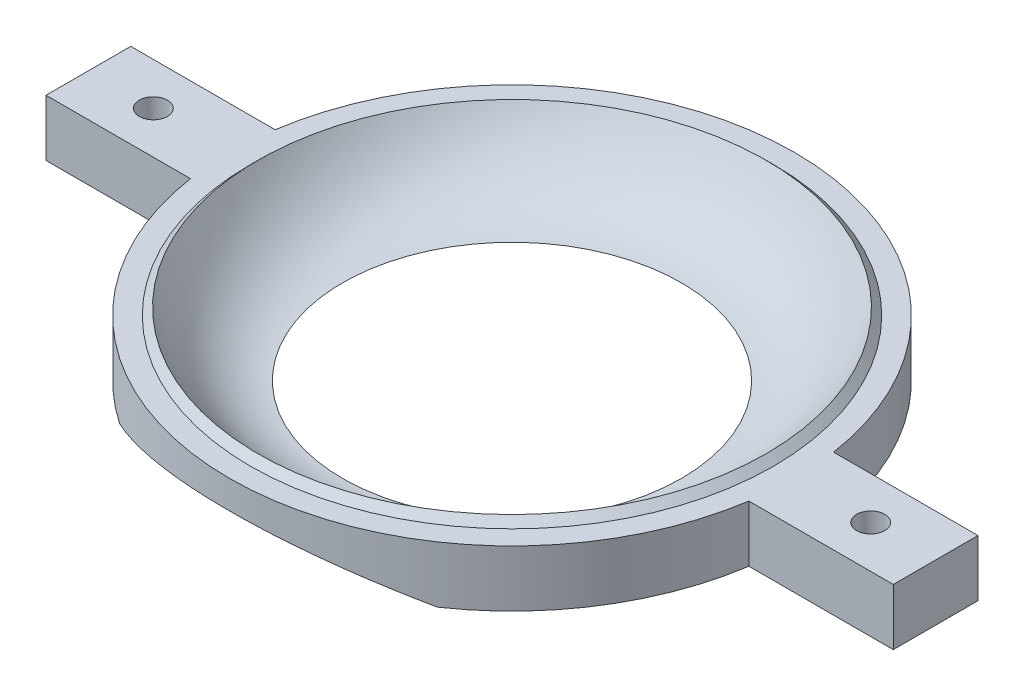
from build123d import *

# Parameters (mm, degrees)
SKETCH1_R           = 0.5
BOSS_EXTRUDE1_DEPTH = 1
CUT_EXTRUDE1_START  = -15
CUT_EXTRUDE1_DEPTH  = 30


with BuildPart() as part:
    # Sketch1 → Boss-Extrude1 (new, symmetric)
    # profile 1 of 14: a face of its own
    with BuildSketch(Plane(origin=(0, 0, 0), x_dir=(1, 0, 0), z_dir=(0, 1, 0))):
        with BuildLine():
            Line((-15, -1.5), (-9.886859967, -1.5))
            ThreePointArc((-9.886859967, -1.5), (-10, 0), (-9.886859967, 1.5))
            Line((-9.886859967, 1.5), (-15, 1.5))
            Line((-15, 1.5), (-15, -1.5))
        make_face()
        with Locations(Location((-12.7, 0, 0), (0, 0, 270))):
            Circle(SKETCH1_R, mode=Mode.SUBTRACT)
    # profile 2 of 14: a face of its own
    with BuildSketch(Plane(origin=(0, 0, 0), x_dir=(1, 0, 0), z_dir=(0, 1, 0))):
        with BuildLine():
            ThreePointArc((-9.886859967, 1.5), (-10, 0), (-9.886859967, -1.5))
            Line((-9.886859967, -1.5), (-8.874119675, -1.5))
            ThreePointArc((-8.874119675, -1.5), (-9, 0), (-8.874119675, 1.5))
            Line((-8.874119675, 1.5), (-9.886859967, 1.5))
        make_face()
    # profile 3 of 14: a face of its own
    with BuildSketch(Plane(origin=(0, 0, 0), x_dir=(1, 0, 0), z_dir=(0, 1, 0))):
        with BuildLine():
            Line((8.874119675, -1.5), (9.886859967, -1.5))
            ThreePointArc((9.886859967, -1.5), (9.971674876, -0.752130419), (10, 0))
            ThreePointArc((10, 0), (9.971674876, 0.752130419), (9.886859967, 1.5))
            Line((9.886859967, 1.5), (8.874119675, 1.5))
            ThreePointArc((8.874119675, 1.5), (8.968474705, 0.752636343), (9, 0))
            ThreePointArc((9, 0), (8.968474705, -0.752636343), (8.874119675, -1.5))
        make_face()
    # profile 4 of 14: a face of its own
    with BuildSketch(Plane(origin=(0, 0, 0), x_dir=(1, 0, 0), z_dir=(0, 1, 0))):
        with BuildLine():
            ThreePointArc((-9.886859967, -1.5), (-6.519202405, -7.582875444), (0, -10))
            Line((0, -10), (0, -9))
            ThreePointArc((0, -9), (-5.809475019, -6.873863542), (-8.874119675, -1.5))
            Line((-8.874119675, -1.5), (-9.886859967, -1.5))
        make_face()
    # profile 5 of 14: a face of its own
    with BuildSketch(Plane(origin=(0, 0, 0), x_dir=(1, 0, 0), z_dir=(0, 1, 0))):
        with BuildLine():
            Line((0, -9), (0, -10))
            ThreePointArc((0, -10), (6.519202405, -7.582875444), (9.886859967, -1.5))
            Line((9.886859967, -1.5), (8.874119675, -1.5))
            ThreePointArc((8.874119675, -1.5), (5.809475019, -6.873863542), (0, -9))
        make_face()
    # profile 6 of 14: a face of its own
    with BuildSketch(Plane(origin=(0, 0, 0), x_dir=(1, 0, 0), z_dir=(0, 1, 0))):
        with BuildLine():
            ThreePointArc((0, 10), (-6.519202405, 7.582875444), (-9.886859967, 1.5))
            Line((-9.886859967, 1.5), (-8.874119675, 1.5))
            ThreePointArc((-8.874119675, 1.5), (-5.809475019, 6.873863542), (0, 9))
            Line((0, 9), (0, 10))
        make_face()
    # profile 7 of 14: a face of its own
    with BuildSketch(Plane(origin=(0, 0, 0), x_dir=(1, 0, 0), z_dir=(0, 1, 0))):
        with BuildLine():
            ThreePointArc((9.886859967, 1.5), (6.519202405, 7.582875444), (0, 10))
            Line((0, 10), (0, 9))
            ThreePointArc((0, 9), (5.809475019, 6.873863542), (8.874119675, 1.5))
            Line((8.874119675, 1.5), (9.886859967, 1.5))
        make_face()
    # profile 8 of 14: a face of its own
    with BuildSketch(Plane(origin=(0, 0, 0), x_dir=(1, 0, 0), z_dir=(0, 1, 0))):
        with BuildLine():
            ThreePointArc((-9.886859967, -1.5), (-6.519202405, -7.582875444), (0, -10))
            Line((0, -10), (0, -9))
            ThreePointArc((0, -9), (-5.809475019, -6.873863542), (-8.874119675, -1.5))
            Line((-8.874119675, -1.5), (-9.886859967, -1.5))
        make_face()
    # profile 9 of 14: a face of its own
    with BuildSketch(Plane(origin=(0, 0, 0), x_dir=(1, 0, 0), z_dir=(0, 1, 0))):
        with BuildLine():
            Line((0, -9), (0, -10))
            ThreePointArc((0, -10), (6.519202405, -7.582875444), (9.886859967, -1.5))
            Line((9.886859967, -1.5), (8.874119675, -1.5))
            ThreePointArc((8.874119675, -1.5), (5.809475019, -6.873863542), (0, -9))
        make_face()
    # profile 10 of 14: a face of its own
    with BuildSketch(Plane(origin=(0, 0, 0), x_dir=(1, 0, 0), z_dir=(0, 1, 0))):
        with BuildLine():
            ThreePointArc((0, 10), (-6.519202405, 7.582875444), (-9.886859967, 1.5))
            Line((-9.886859967, 1.5), (-8.874119675, 1.5))
            ThreePointArc((-8.874119675, 1.5), (-5.809475019, 6.873863542), (0, 9))
            Line((0, 9), (0, 10))
        make_face()
    # profile 11 of 14: a face of its own
    with BuildSketch(Plane(origin=(0, 0, 0), x_dir=(1, 0, 0), z_dir=(0, 1, 0))):
        with BuildLine():
            ThreePointArc((9.886859967, 1.5), (6.519202405, 7.582875444), (0, 10))
            Line((0, 10), (0, 9))
            ThreePointArc((0, 9), (5.809475019, 6.873863542), (8.874119675, 1.5))
            Line((8.874119675, 1.5), (9.886859967, 1.5))
        make_face()
    # profile 12 of 14: a face of its own
    with BuildSketch(Plane(origin=(0, 0, 0), x_dir=(1, 0, 0), z_dir=(0, 1, 0))):
        with BuildLine():
            ThreePointArc((10, 0), (9.971674876, -0.752130419), (9.886859967, -1.5))
            Line((9.886859967, -1.5), (15, -1.5))
            Line((15, -1.5), (15, 1.5))
            Line((15, 1.5), (9.886859967, 1.5))
            ThreePointArc((9.886859967, 1.5), (9.971674876, 0.752130419), (10, 0))
        make_face()
        with Locations(Location((12.7, 0, 0), (0, 0, 270))):
            Circle(SKETCH1_R, mode=Mode.SUBTRACT)
    # profile 13 of 14: a face of its own
    with BuildSketch(Plane(origin=(0, 0, 0), x_dir=(1, 0, 0), z_dir=(0, 1, 0))):
        with BuildLine():
            ThreePointArc((-9.886859967, 1.5), (-10, 0), (-9.886859967, -1.5))
            Line((-9.886859967, -1.5), (-8.874119675, -1.5))
            ThreePointArc((-8.874119675, -1.5), (-9, 0), (-8.874119675, 1.5))
            Line((-8.874119675, 1.5), (-9.886859967, 1.5))
        make_face()
    # profile 14 of 14: a face of its own
    with BuildSketch(Plane(origin=(0, 0, 0), x_dir=(1, 0, 0), z_dir=(0, 1, 0))):
        with BuildLine():
            Line((8.874119675, -1.5), (9.886859967, -1.5))
            ThreePointArc((9.886859967, -1.5), (9.971674876, -0.752130419), (10, 0))
            ThreePointArc((10, 0), (9.971674876, 0.752130419), (9.886859967, 1.5))
            Line((9.886859967, 1.5), (8.874119675, 1.5))
            ThreePointArc((8.874119675, 1.5), (8.968474705, 0.752636343), (9, 0))
            ThreePointArc((9, 0), (8.968474705, -0.752636343), (8.874119675, -1.5))
        make_face()
    extrude(amount=BOSS_EXTRUDE1_DEPTH, both=True)

    # Sketch5 → Revolve1 (revolve)
    with BuildSketch(Plane.XY, mode=Mode.PRIVATE) as revolve1_sk:
        with BuildLine():
            Line((-9, 1.256849708), (-9.256849708, 1))
            Line((-9.256849708, 1), (-9.256849708, -1))
            Line((-9.256849708, -1), (-8, -1))
            Line((-8, -1), (-6, -1))
            add(Edge.make_bspline(
                [(-9, 1.256849708), (-7.866217648, -0.858961069), (-6, -1)],
                knots=[0, 0, 0, 0.981692631, 0.981692631, 0.981692631], degree=2))
        make_face()
    revolve(revolve1_sk.sketch.rotate(Axis((0, -1000, 0), (0, 1, 0)), 180), axis=Axis((0, -1000, 0), (0, 1, 0)))

    # Sketch6 → Cut-Extrude1 (cut)
    with BuildSketch(Plane(origin=(0, 0, 0), x_dir=(0, 0, -1), z_dir=(1, 0, 0)).offset(CUT_EXTRUDE1_START)):
        Polygon((10, 0), (10, -1), (8.267949192, -1), align=None)
        Polygon((-10, 0), (-10, -1), (-8.267949192, -1), align=None)
    extrude(amount=CUT_EXTRUDE1_DEPTH, mode=Mode.SUBTRACT)


solid = part.part
